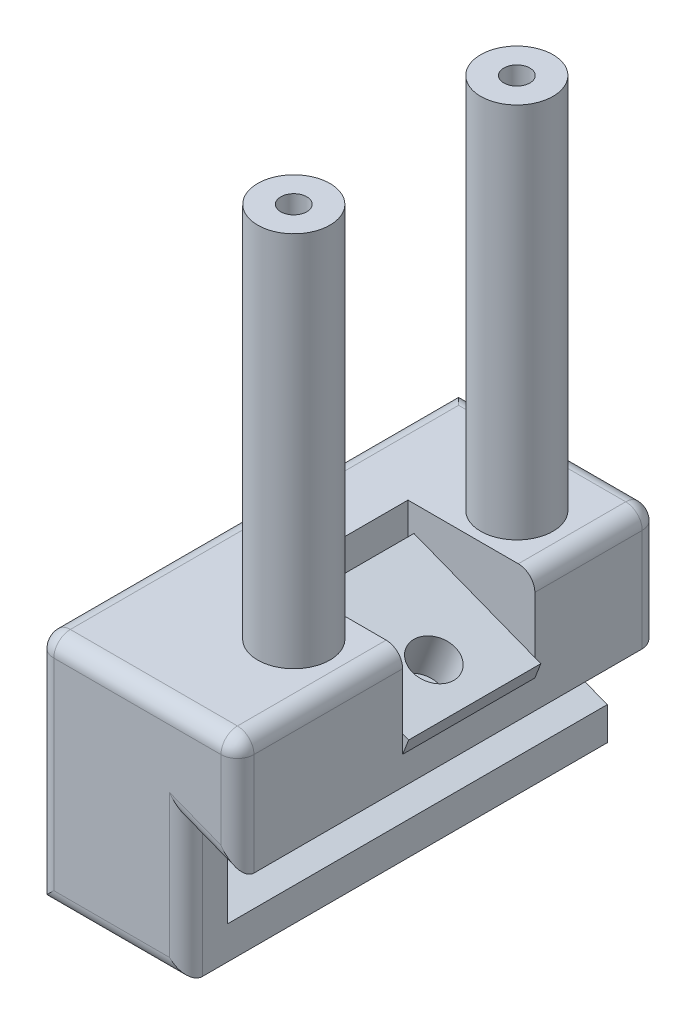
from build123d import *

# Parameters (mm, degrees)
BOSS_EXTRUDE1_DEPTH  = 58.42
SKETCH2_W            = 22.86
SKETCH2_H            = 29.69248518
BOSS_EXTRUDE2_DEPTH  = 6.35
BOSS_EXTRUDE3_DEPTH  = 58.42
CUT_EXTRUDE1_DEPTH   = 58.42
BOSS_EXTRUDE5_DEPTH  = 19.05
BOSS_EXTRUDE6_DEPTH  = 19.05
SKETCH8_R            = 3.3
CUT_EXTRUDE2_DEPTH   = 4.085289
SKETCH9_R            = 5.55625
BOSS_EXTRUDE7_DEPTH  = 64.262
SKETCH11_R           = 1.999996
CUT_EXTRUDE3_DEPTH   = 6.99999997
BOSS_EXTRUDE8_DEPTH  = 6.35
BOSS_EXTRUDE9_DEPTH  = 6.35
FILLET3_R            = 2.54
BOSS_EXTRUDE10_START = 2.54
SKETCH15_W           = 20.926247949
SKETCH15_H           = 20.32
SKETCH15_R           = 3.3
BOSS_EXTRUDE10_DEPTH = 2.54


with BuildPart() as part:
    # Sketch1 → Boss-Extrude1 (new body)
    with BuildSketch(Plane.XY):
        Polygon((0, 0), (22.86, 0), (22.86, 5.08), (0, 13.97), align=None)
    extrude(amount=BOSS_EXTRUDE1_DEPTH)

    # Sketch2 → Boss-Extrude2 (add)
    with BuildSketch(Plane.XY.offset(58.42)):
        with Locations((11.43, 14.84624259)):
            Rectangle(SKETCH2_W, SKETCH2_H)
    extrude(amount=BOSS_EXTRUDE2_DEPTH)

    # Sketch3 → Boss-Extrude3 (add)
    with BuildSketch(Plane(origin=(0, 0, 58.42), x_dir=(-1, 0, 0), z_dir=(0, 0, -1))):
        Polygon((-22.86, 29.69248518), (0, 29.69248518), (-30.774794254, 17.724509637), (-30.774794254, 29.69248518), align=None)
    extrude(amount=BOSS_EXTRUDE3_DEPTH)

    # Sketch5 → Cut-Extrude1 (cut)
    with BuildSketch(Plane(origin=(0, 0, 0), x_dir=(-1, 0, 0), z_dir=(0, 0, -1))):
        Polygon((-30.774794254, 22.107844851), (-11.271433408, 29.69248518), (-30.774794254, 29.69248518), align=None)
    extrude(amount=-CUT_EXTRUDE1_DEPTH, mode=Mode.SUBTRACT)

    # Sketch7 → Boss-Extrude6 (add)
    with BuildSketch(Plane.XY.offset(58.42)):
        Polygon((30.774794254, 22.107844851), (30.774794254, 29.69248518), (11.271433408, 29.69248518), align=None)
    extrude(amount=-BOSS_EXTRUDE6_DEPTH)

    # Sketch8 → Cut-Extrude2 (cut)
    with BuildSketch(Plane(origin=(11.510866943, 29.599372139, 0), x_dir=(0.9320046715412958, -0.36244626115494866, 0), z_dir=(0.36244626115494866, 0.9320046715412958, 0))):
        with Locations(Location((13.92329977, -29.21, 0), (0, 0, 180))):
            Circle(SKETCH8_R)
    extrude(amount=-CUT_EXTRUDE2_DEPTH, mode=Mode.SUBTRACT)



with BuildPart() as body_2:
    # Sketch6 → Boss-Extrude5 (new body)
    with BuildSketch(Plane(origin=(0, 0, 0), x_dir=(-1, 0, 0), z_dir=(0, 0, -1))):
        Polygon((-30.774794254, 29.69248518), (-30.774794254, 22.107844851), (-11.271433408, 29.69248518), align=None)
    extrude(amount=-BOSS_EXTRUDE5_DEPTH)


with BuildPart() as part_1:
    add(part.part)

    add(body_2.part)  # Boss-Extrude7 merges body 2
    # Sketch9 → Boss-Extrude7 (add)
    with BuildSketch(Plane(origin=(0, 29.69248518, 0), x_dir=(1, 0, 0), z_dir=(0, 1, 0))):
        with Locations(Location((21.023113831, -12.065, 0), (0, 0, 270))):
            Circle(SKETCH9_R)
        with Locations(Location((21.023113831, -46.355, 0), (0, 0, 270))):
            Circle(SKETCH9_R)
    extrude(amount=BOSS_EXTRUDE7_DEPTH)

    # Sketch11 → Cut-Extrude3 (cut)
    with BuildSketch(Plane(origin=(0, 93.95448518, 0), x_dir=(1, 0, 0), z_dir=(0, 1, 0))):
        with Locations(Location((21.023113831, -12.065, 0), (0, 0, 270))):
            Circle(SKETCH11_R)
        with Locations(Location((21.023113831, -46.355, 0), (0, 0, 270))):
            Circle(SKETCH11_R)
    extrude(amount=-CUT_EXTRUDE3_DEPTH, mode=Mode.SUBTRACT)

    # Sketch12 → Boss-Extrude8 (add)
    with BuildSketch(Plane.XY.offset(58.42)):
        Polygon((22.86, 29.69248518), (30.774794254, 29.69248518), (30.774794254, 17.724509637), (22.86, 20.80248518), align=None)
    extrude(amount=BOSS_EXTRUDE8_DEPTH)

    # Sketch14 → Boss-Extrude9 (add)
    with BuildSketch(Plane(origin=(0, 29.69248518, 0), x_dir=(1, 0, 0), z_dir=(0, 1, 0))):
        Polygon((0, 0), (0, -64.77), (30.774794254, -64.77), (30.774794254, -39.37), (11.271433408, -39.37), (11.271433408, -19.05), (30.774794254, -19.05), (30.774794254, 0), align=None)
    extrude(amount=BOSS_EXTRUDE9_DEPTH)

    # Fillet3
    fillet3_edges = [part_1.edges().sort_by_distance(p)[0] for p in [
        (0, 18.02124259, 64.77),
        (15.387397127, 36.04248518, 64.77),
        (30.774794254, 26.883497409, 0),
        (30.774794254, 26.883497409, 64.77),
        (26.817397127, 19.263497409, 64.77),
        (22.86, 10.40124259, 64.77),
        (11.43, 0, 64.77),
        (0, 6.985, 0),
        (15.387397127, 36.04248518, 0),
        (0, 36.04248518, 32.385),
        (30.774794254, 36.04248518, 52.07),
        (30.774794254, 36.04248518, 9.525),
    ]]
    fillet(fillet3_edges, radius=FILLET3_R)

    # Sketch15 → Boss-Extrude10 (add)
    with BuildSketch(Plane(origin=(11.510866943, 29.599372139, 0), x_dir=(0.9320046715412958, -0.3624462611549486, 0), z_dir=(0.3624462611549486, 0.9320046715412958, 0)).offset(BOSS_EXTRUDE10_START)):
        with Locations((10.206222328, -29.21)):
            Rectangle(SKETCH15_W, SKETCH15_H)
        with Locations(Location((13.92329977, -29.21, 0), (0, 0, 180))):
            Circle(SKETCH15_R, mode=Mode.SUBTRACT)
    extrude(amount=-BOSS_EXTRUDE10_DEPTH)


solid = part_1.part
